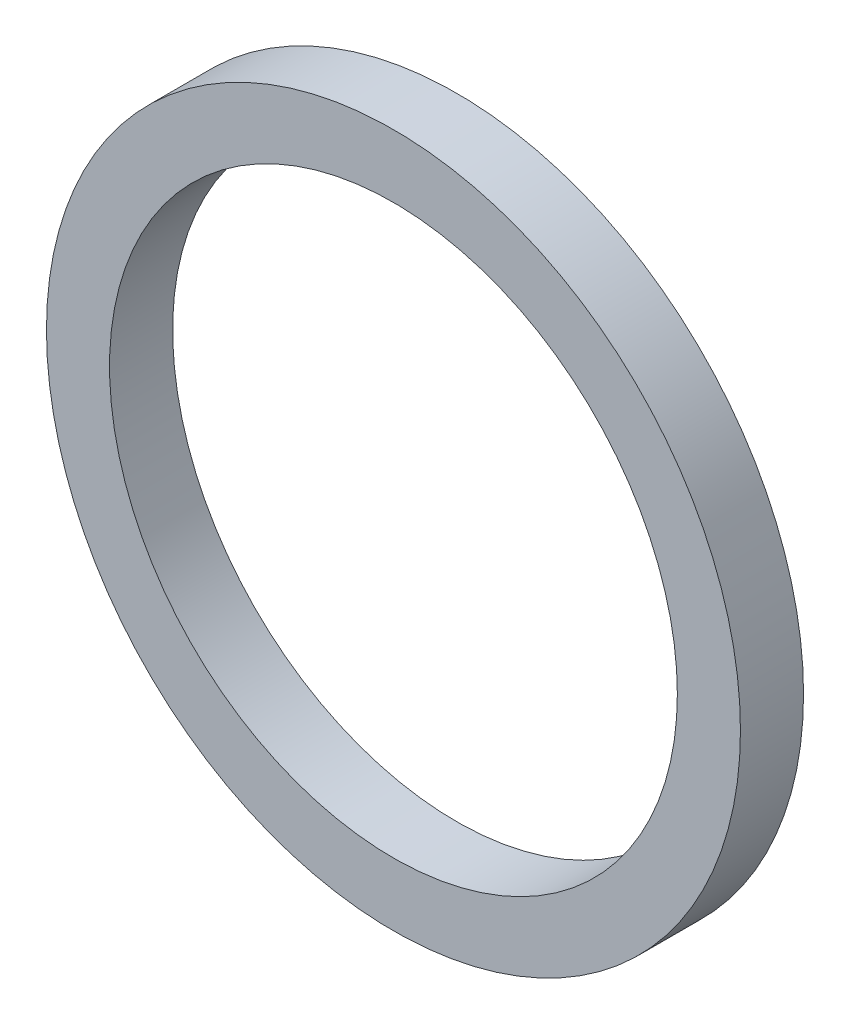
from build123d import *

# Parameters (mm, degrees)
SKETCH1_R           = 55
SKETCH1_R_2         = 45
BOSS_EXTRUDE1_DEPTH = 10


with BuildPart() as part:
    # Sketch1 → Boss-Extrude1 (new body)
    with BuildSketch(Plane(origin=(0, 0, 0), x_dir=(0, 1, 0), z_dir=(0, 0, 1))):
        with Locations(Location((0, 0, 0), (0, 0, 270))):
            Circle(SKETCH1_R)
        with Locations(Location((0, 0, 0), (0, 0, 270))):
            Circle(SKETCH1_R_2, mode=Mode.SUBTRACT)
    extrude(amount=BOSS_EXTRUDE1_DEPTH)


solid = part.part
